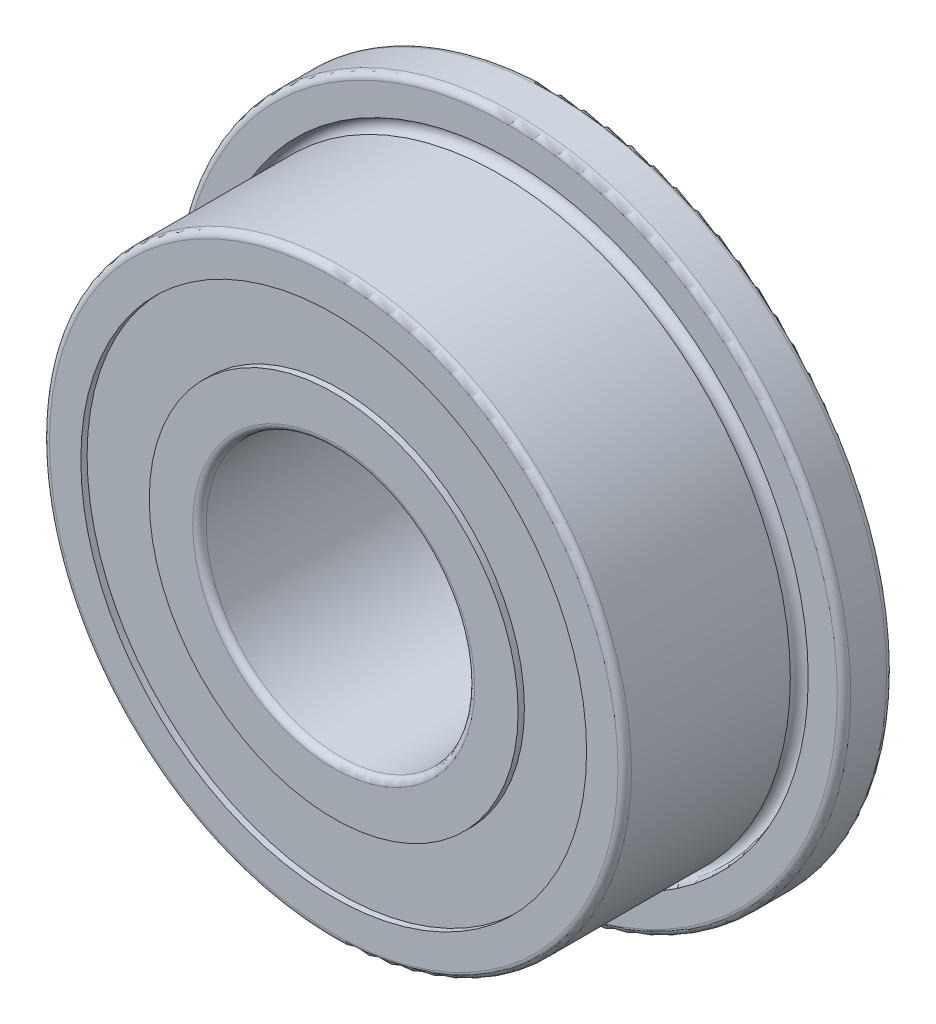
from build123d import *


with BuildPart() as part:
    # Esquisse1 → Révolution1 (revolve)
    with BuildSketch(Plane(origin=(0, 0, 0), x_dir=(0, 0, -1), z_dir=(1, 0, 0)), mode=Mode.PRIVATE) as r_volution1_sk:
        with BuildLine():
            Line((0, 6.35), (0, 5.649))
            Line((0, 5.649), (0.14, 5.649))
            Line((0.14, 5.649), (0.14, 4.12))
            Line((0.14, 4.12), (0, 4.12))
            Line((0, 4.12), (0, 3.15))
            ThreePointArc((0, 3.15), (0.043933983, 3.043933983), (0.15, 3))
            Line((0.15, 3), (4.85, 3))
            ThreePointArc((4.85, 3), (4.956066017, 3.043933983), (5, 3.15))
            Line((5, 3.15), (5, 4.12))
            Line((5, 4.12), (4.86, 4.12))
            Line((4.86, 4.12), (4.86, 5.649))
            Line((4.86, 5.649), (5, 5.649))
            Line((5, 5.649), (5, 7.35))
            ThreePointArc((5, 7.35), (4.956066017, 7.456066017), (4.85, 7.5))
            Line((4.85, 7.5), (4.05, 7.5))
            ThreePointArc((4.05, 7.5), (3.943933983, 7.456066017), (3.9, 7.35))
            Line((3.9, 7.35), (3.9, 6.7))
            ThreePointArc((3.9, 6.7), (4.041421356, 6.358578644), (3.7, 6.5))
            Line((3.7, 6.5), (0.15, 6.5))
            ThreePointArc((0.15, 6.5), (0.043933983, 6.456066017), (0, 6.35))
        make_face()
    revolve(r_volution1_sk.sketch.rotate(Axis((0, 0, -5), (0, 0, 1)), 270), axis=Axis((0, 0, -5), (0, 0, 1)))


solid = part.part
